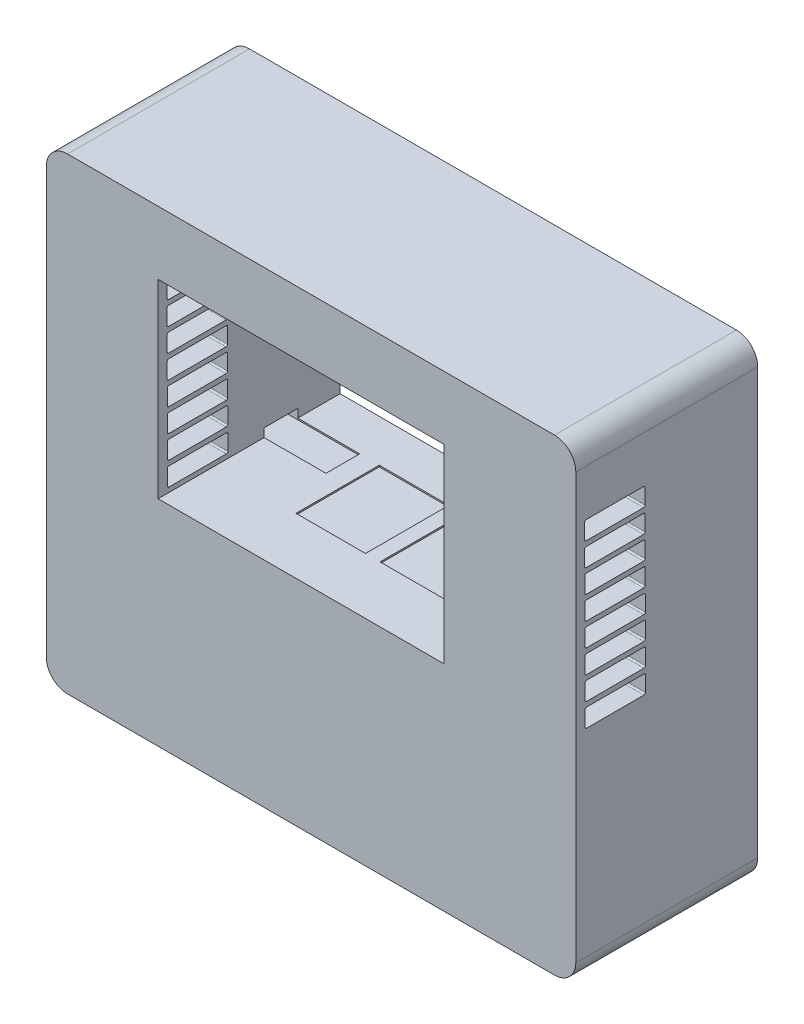
from build123d import *

# Parameters (mm, degrees)
SKETCH1_W               = 57.8
SKETCH1_H               = 38.4
BOSS_EXTRUDE1_DEPTH     = 36.766
SKETCH3_W               = 8.89
SKETCH3_H               = 3.43
SKETCH3_W_2             = 14.05
SKETCH3_H_2             = 16.84
SKETCH3_W_3             = 17.696
SKETCH3_H_3             = 6.81
SKETCH3_W_4             = 9.3
SKETCH3_H_4             = 11
CUT_EXTRUDE1_DEPTH      = 2
CUT_EXTRUDE2_DEPTH      = 51
CUT_EXTRUDE2_DEPTH_BACK = 145


with BuildPart() as part:
    # Sketch1 → Boss-Extrude1 (new body)
    with BuildSketch(Plane.XY):
        with BuildLine():
            Line((84, 51.09), (-14.4, 51.09))
            ThreePointArc((-14.4, 51.09), (-17.440559159, 49.830559159), (-18.7, 46.79))
            Line((-18.7, 46.79), (-18.7, -39.11))
            ThreePointArc((-18.7, -39.11), (-17.440559159, -42.150559159), (-14.4, -43.41))
            Line((-14.4, -43.41), (84, -43.41))
            ThreePointArc((84, -43.41), (87.040559159, -42.150559159), (88.3, -39.11))
            Line((88.3, -39.11), (88.3, 46.79))
            ThreePointArc((88.3, 46.79), (87.040559159, 49.830559159), (84, 51.09))
        make_face()
        with Locations((32.8, 19.1)):
            Rectangle(SKETCH1_W, SKETCH1_H, mode=Mode.SUBTRACT)
    extrude(amount=-BOSS_EXTRUDE1_DEPTH)

    # Sketch3 → Cut-Extrude1 (cut)
    with BuildSketch(Plane.XZ.offset(0.4)):
        with Locations((76.775, -26.5048)):
            Rectangle(SKETCH3_W, SKETCH3_H)
        Polygon((68.12, -28.296), (69.827, -28.296), (69.827, -14.646007205), (68.12, -14.646007205), (66.12, -14.646007205), (57.38, -14.646007205), (55.38, -14.646007205), (53.673, -14.646007205), (53.673, -28.296), (55.38, -28.296), (57.38, -28.296), (66.12, -28.296), align=None)
        with Locations((44.4, -19.7998)):
            Rectangle(SKETCH3_W_2, SKETCH3_H_2)
        with Locations((27.4, -19.7998)):
            Rectangle(SKETCH3_W_2, SKETCH3_H_2)
        with Locations((7.56, -24.8148)):
            Rectangle(SKETCH3_W_3, SKETCH3_H_3)
        with Locations((-9.2, -22.796)):
            Rectangle(SKETCH3_W_4, SKETCH3_H_4)
    extrude(amount=-CUT_EXTRUDE1_DEPTH, mode=Mode.SUBTRACT)

    # Sketch5 → Cut-Extrude2 (cut, two sides: drawn at the far end of the back side and taken through both)
    with BuildSketch(Plane.ZY.offset(18.7).offset(-CUT_EXTRUDE2_DEPTH_BACK)):
        with BuildLine():
            Line((-1.8, 29.3), (-1.8, 32.4))
            ThreePointArc((-1.8, 32.4), (-1.887867966, 32.612132034), (-2.1, 32.7))
            Line((-2.1, 32.7), (-13.7, 32.7))
            ThreePointArc((-13.7, 32.7), (-13.912132034, 32.612132034), (-14, 32.4))
            Line((-14, 32.4), (-14, 29.3))
            ThreePointArc((-14, 29.3), (-13.912132034, 29.087867966), (-13.7, 29))
            Line((-13.7, 29), (-2.1, 29))
            ThreePointArc((-2.1, 29), (-1.887867966, 29.087867966), (-1.8, 29.3))
        make_face()
        with BuildLine():
            Line((-1.8, 34), (-1.8, 37.1))
            ThreePointArc((-1.8, 37.1), (-1.887867966, 37.312132034), (-2.1, 37.4))
            Line((-2.1, 37.4), (-13.7, 37.4))
            ThreePointArc((-13.7, 37.4), (-13.912132034, 37.312132034), (-14, 37.1))
            Line((-14, 37.1), (-14, 34))
            ThreePointArc((-14, 34), (-13.912132034, 33.787867966), (-13.7, 33.7))
            Line((-13.7, 33.7), (-2.1, 33.7))
            ThreePointArc((-2.1, 33.7), (-1.887867966, 33.787867966), (-1.8, 34))
        make_face()
        with BuildLine():
            Line((-1.828055121, 19.918340263), (-1.828055121, 23.018340263))
            ThreePointArc((-1.828055121, 23.018340263), (-1.915923087, 23.230472298), (-2.128055121, 23.318340263))
            Line((-2.128055121, 23.318340263), (-13.728055121, 23.318340263))
            ThreePointArc((-13.728055121, 23.318340263), (-13.940187155, 23.230472298), (-14.028055121, 23.018340263))
            Line((-14.028055121, 23.018340263), (-14.028055121, 19.918340263))
            ThreePointArc((-14.028055121, 19.918340263), (-13.940187155, 19.706208229), (-13.728055121, 19.618340263))
            Line((-13.728055121, 19.618340263), (-2.128055121, 19.618340263))
            ThreePointArc((-2.128055121, 19.618340263), (-1.915923087, 19.706208229), (-1.828055121, 19.918340263))
        make_face()
        with BuildLine():
            Line((-1.828055121, 24.618340263), (-1.828055121, 27.718340263))
            ThreePointArc((-1.828055121, 27.718340263), (-1.915923087, 27.930472298), (-2.128055121, 28.018340263))
            Line((-2.128055121, 28.018340263), (-13.728055121, 28.018340263))
            ThreePointArc((-13.728055121, 28.018340263), (-13.940187155, 27.930472298), (-14.028055121, 27.718340263))
            Line((-14.028055121, 27.718340263), (-14.028055121, 24.618340263))
            ThreePointArc((-14.028055121, 24.618340263), (-13.940187155, 24.406208229), (-13.728055121, 24.318340263))
            Line((-13.728055121, 24.318340263), (-2.128055121, 24.318340263))
            ThreePointArc((-2.128055121, 24.318340263), (-1.915923087, 24.406208229), (-1.828055121, 24.618340263))
        make_face()
        with BuildLine():
            Line((-1.856110242, 10.536680527), (-1.856110242, 13.636680527))
            ThreePointArc((-1.856110242, 13.636680527), (-1.943978208, 13.848812561), (-2.156110242, 13.936680527))
            Line((-2.156110242, 13.936680527), (-13.756110242, 13.936680527))
            ThreePointArc((-13.756110242, 13.936680527), (-13.968242277, 13.848812561), (-14.056110242, 13.636680527))
            Line((-14.056110242, 13.636680527), (-14.056110242, 10.536680527))
            ThreePointArc((-14.056110242, 10.536680527), (-13.968242277, 10.324548493), (-13.756110242, 10.236680527))
            Line((-13.756110242, 10.236680527), (-2.156110242, 10.236680527))
            ThreePointArc((-2.156110242, 10.236680527), (-1.943978208, 10.324548493), (-1.856110242, 10.536680527))
        make_face()
        with BuildLine():
            Line((-1.856110242, 15.236680527), (-1.856110242, 18.336680527))
            ThreePointArc((-1.856110242, 18.336680527), (-1.943978208, 18.548812561), (-2.156110242, 18.636680527))
            Line((-2.156110242, 18.636680527), (-13.756110242, 18.636680527))
            ThreePointArc((-13.756110242, 18.636680527), (-13.968242277, 18.548812561), (-14.056110242, 18.336680527))
            Line((-14.056110242, 18.336680527), (-14.056110242, 15.236680527))
            ThreePointArc((-14.056110242, 15.236680527), (-13.968242277, 15.024548493), (-13.756110242, 14.936680527))
            Line((-13.756110242, 14.936680527), (-2.156110242, 14.936680527))
            ThreePointArc((-2.156110242, 14.936680527), (-1.943978208, 15.024548493), (-1.856110242, 15.236680527))
        make_face()
        with BuildLine():
            Line((-1.884165363, 1.15502079), (-1.884165363, 4.25502079))
            ThreePointArc((-1.884165363, 4.25502079), (-1.972033329, 4.467152825), (-2.184165363, 4.55502079))
            Line((-2.184165363, 4.55502079), (-13.784165363, 4.55502079))
            ThreePointArc((-13.784165363, 4.55502079), (-13.996297398, 4.467152825), (-14.084165363, 4.25502079))
            Line((-14.084165363, 4.25502079), (-14.084165363, 1.15502079))
            ThreePointArc((-14.084165363, 1.15502079), (-13.996297398, 0.942888756), (-13.784165363, 0.85502079))
            Line((-13.784165363, 0.85502079), (-2.184165363, 0.85502079))
            ThreePointArc((-2.184165363, 0.85502079), (-1.972033329, 0.942888756), (-1.884165363, 1.15502079))
        make_face()
        with BuildLine():
            Line((-1.884165363, 5.85502079), (-1.884165363, 8.95502079))
            ThreePointArc((-1.884165363, 8.95502079), (-1.972033329, 9.167152825), (-2.184165363, 9.25502079))
            Line((-2.184165363, 9.25502079), (-13.784165363, 9.25502079))
            ThreePointArc((-13.784165363, 9.25502079), (-13.996297398, 9.167152825), (-14.084165363, 8.95502079))
            Line((-14.084165363, 8.95502079), (-14.084165363, 5.85502079))
            ThreePointArc((-14.084165363, 5.85502079), (-13.996297398, 5.642888756), (-13.784165363, 5.55502079))
            Line((-13.784165363, 5.55502079), (-2.184165363, 5.55502079))
            ThreePointArc((-2.184165363, 5.55502079), (-1.972033329, 5.642888756), (-1.884165363, 5.85502079))
        make_face()
    extrude(amount=CUT_EXTRUDE2_DEPTH + CUT_EXTRUDE2_DEPTH_BACK, mode=Mode.SUBTRACT)


solid = part.part
